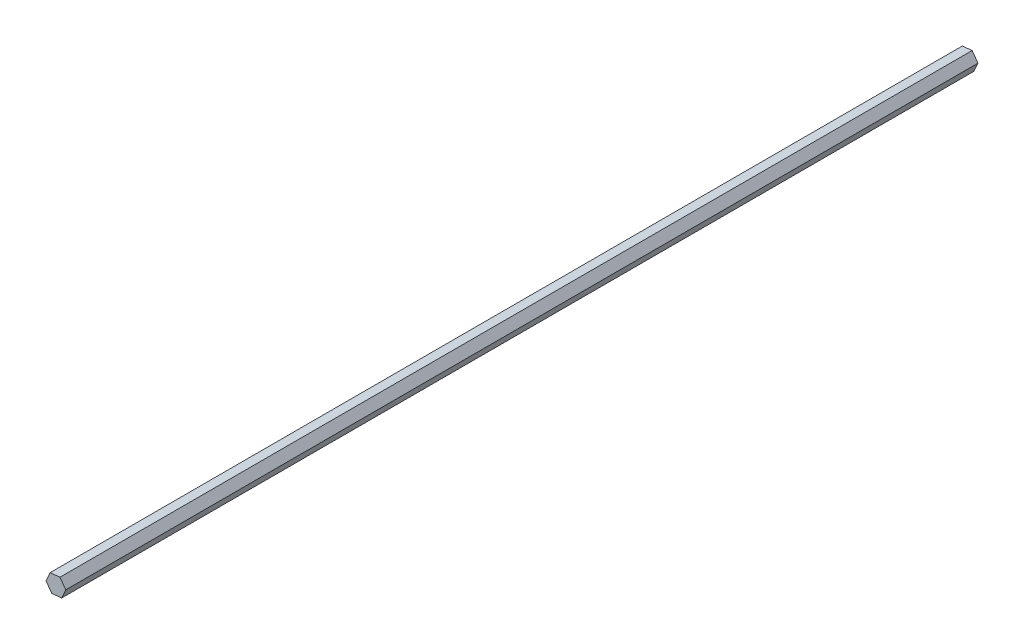
from build123d import *

# Parameters (mm, degrees)
BOSS_EXTRUDE1_DEPTH = 673.1


with BuildPart() as part:
    # Sketch1 → Boss-Extrude1 (new body)
    with BuildSketch(Plane.XY):
        Polygon((-4.307451229, 5.933733836), (-7.292489856, -0.763495272), (-2.985038627, -6.697229108), (4.307451229, -5.933733836), (7.292489856, 0.763495272), (2.985038627, 6.697229108), align=None)
    extrude(amount=BOSS_EXTRUDE1_DEPTH)


solid = part.part
